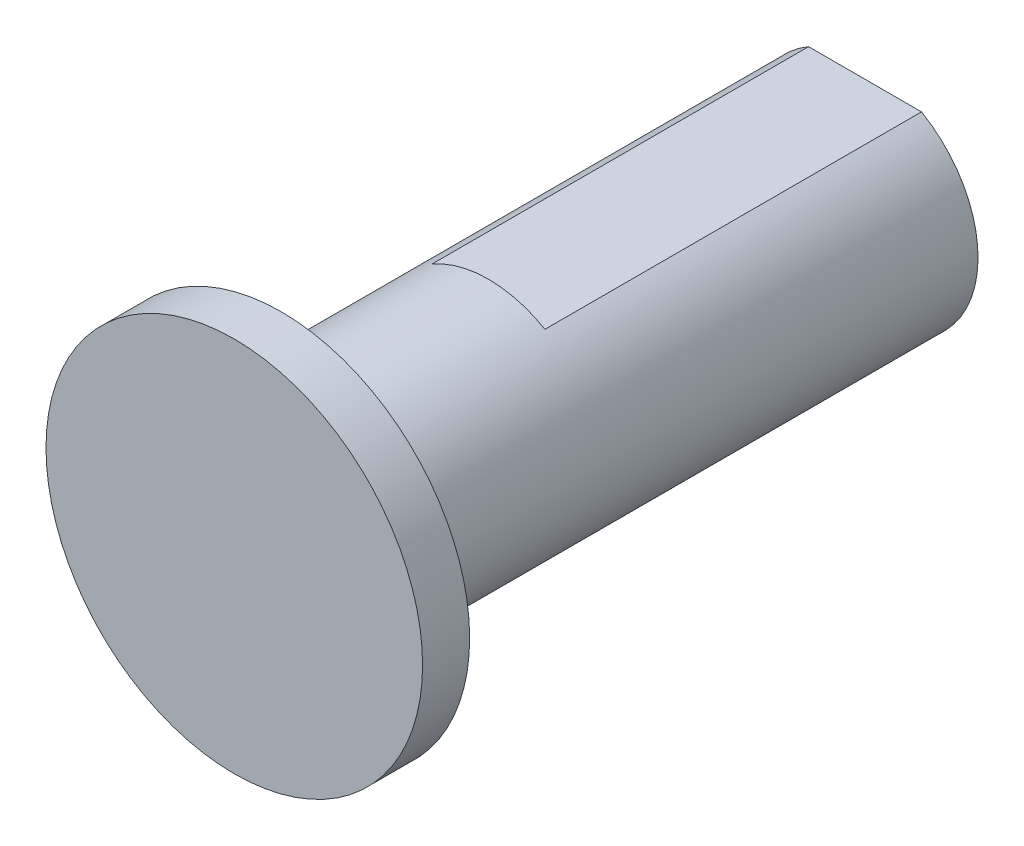
from build123d import *

# Parameters (mm, degrees)
SKETCH1_R           = 6
BOSS_EXTRUDE1_DEPTH = 31
CUT_EXTRUDE1_DEPTH  = 20
SKETCH3_R           = 10
BOSS_EXTRUDE2_DEPTH = 2.5


with BuildPart() as part:
    # Sketch1 → Boss-Extrude1 (new body)
    with BuildSketch(Plane.XY):
        Circle(SKETCH1_R)
    extrude(amount=BOSS_EXTRUDE1_DEPTH)

    # Sketch2 → Cut-Extrude1 (cut)
    with BuildSketch(Plane(origin=(0, 0, 0), x_dir=(-1, 0, 0), z_dir=(0, 0, -1))):
        Polygon((-41.730042052, 5.196152423), (-3, 5.196152423), (3, 5.196152423), (41.730042052, 5.196152423), (41.730042052, 82.656236526), (-41.730042052, 82.656236526), align=None)
    extrude(amount=-CUT_EXTRUDE1_DEPTH, mode=Mode.SUBTRACT)

    # Sketch3 → Boss-Extrude2 (add)
    with BuildSketch(Plane.XY.offset(31)):
        Circle(SKETCH3_R)
    extrude(amount=BOSS_EXTRUDE2_DEPTH)


solid = part.part
